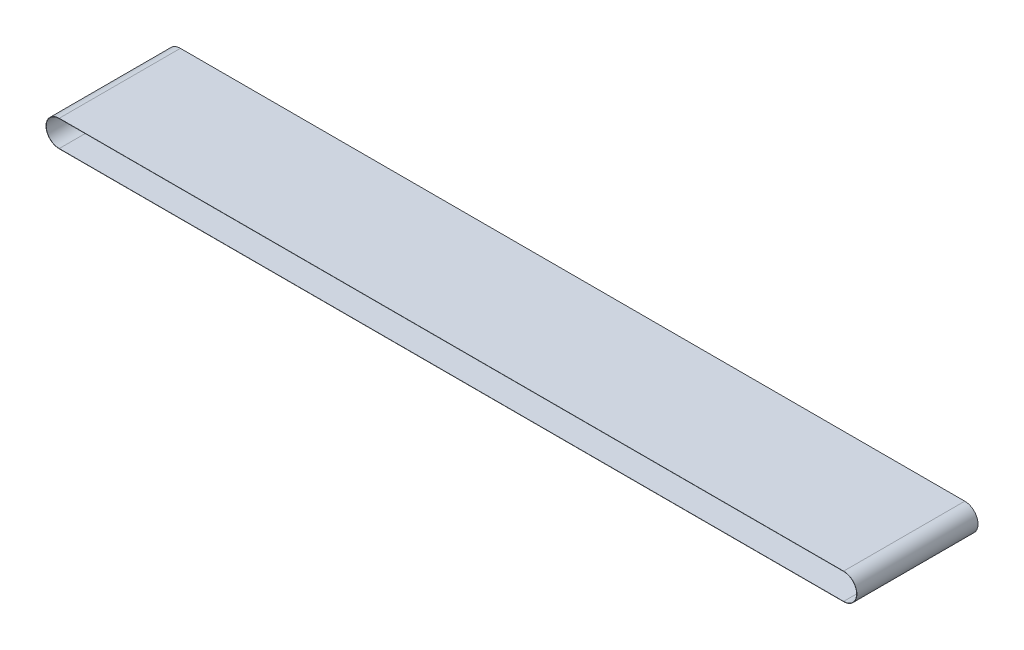
from build123d import *

# Parameters (mm, degrees)
SKETCH_3_W = 1525
SKETCH_3_H = 3


with BuildPart() as part:
    # 扫描1: sweep along a path in 草图2
    with BuildLine(Plane.XY) as sweep_1_path:
        Line((0, -165), (-9873.276111442, -165))
        ThreePointArc((-9873.276111442, -165), (-10038.276111442, 0), (-9873.276111442, 165))
        Line((-9873.276111442, 165), (0, 165))
        ThreePointArc((0, 165), (165, 0), (0, -165))
    # 草图3 → 扫描1 (sweep)
    with BuildSketch(Plane(origin=(0, 0, 0), x_dir=(0, 0, -1), z_dir=(1, 0, 0))):
        with Locations((0, 165)):
            Rectangle(SKETCH_3_W, SKETCH_3_H)
    sweep(path=sweep_1_path.line)


solid = part.part
